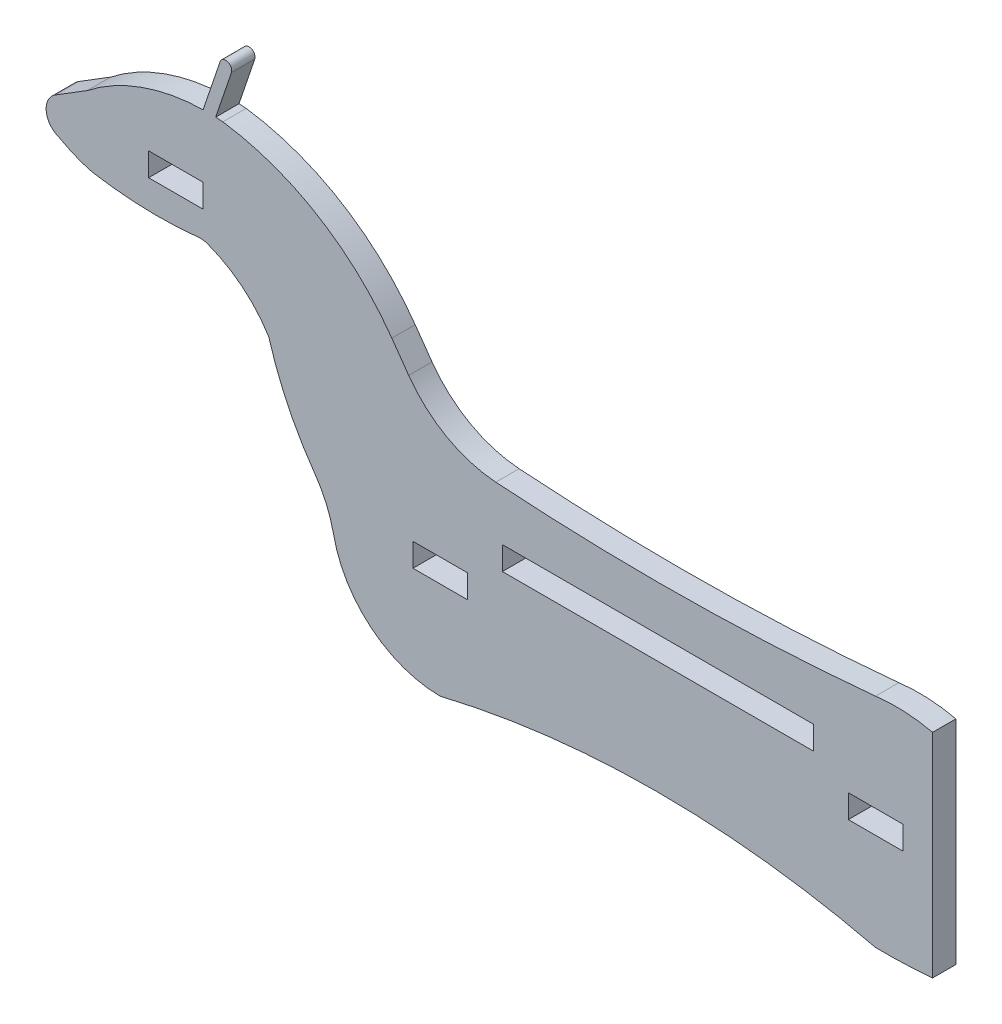
from build123d import *

# Parameters (mm, degrees)
CROQUIS1_W              = 7
CROQUIS1_H              = 3
CROQUIS1_W_2            = 40
SALIENTE_EXTRUIR2_DEPTH = 3


with BuildPart() as part:
    # Croquis1 → Saliente-Extruir2 (new body)
    # profile 1 of 2: a face of its own
    with BuildSketch(Plane.XY):
        with BuildLine():
            Line((-6.216662119, 22.772706787), (-4.044005239, 19.70673965))
            ThreePointArc((-4.044005239, 19.70673965), (0.846790636, 15.302410265), (7.152221482, 13.415735026))
            ThreePointArc((7.152221482, 13.415735026), (31.588023052, 12.711932525), (56, 14))
            ThreePointArc((56, 14), (59.681690996, 14.144560896), (63.331119209, 13.637194987))
            Line((63.331119209, 13.637194987), (63.331119209, -13.72746384))
            ThreePointArc((63.331119209, -13.72746384), (59.669008788, -13.956513649), (56, -14))
            ThreePointArc((56, -14), (28, -10.687617167), (0, -14))
            ThreePointArc((0, -14), (-8.837271963, -10.858297484), (-13.708246846, -2.843232035))
            ThreePointArc((-13.708246846, -2.843232035), (-14.641013119, 0.09458105), (-16.154579725, 2.779709497))
            ThreePointArc((-16.154579725, 2.779709497), (-19.611540214, 8.64494659), (-22.043834508, 15.003840083))
            ThreePointArc((-22.043834508, 15.003840083), (-25.456865091, 18.879465716), (-29.94492332, 21.43418393))
            ThreePointArc((-29.94492332, 21.43418393), (-30.498768872, 21.56832041), (-31.068602309, 21.573549568))
            ThreePointArc((-31.068602309, 21.573549568), (-37.926515157, 21.320049962), (-44.755343643, 22.000000093))
            ThreePointArc((-44.755343643, 22.000000093), (-46.844869797, 22.679955064), (-48.825598798, 23.631359783))
            ThreePointArc((-48.825598798, 23.631359783), (-48.970768016, 23.707234664), (-49.120594345, 23.773440183))
            ThreePointArc((-49.120594345, 23.773440183), (-50.676363257, 25.877313669), (-49.50357007, 28.216385428))
            Line((-49.50357007, 28.216385428), (-45.399966171, 30.762281564))
            ThreePointArc((-45.399966171, 30.762281564), (-37.171530842, 35.026305913), (-27.955174947, 35.999874419))
            ThreePointArc((-27.955174947, 35.999874419), (-15.716017532, 31.637687979), (-6.216662119, 22.772706787))
        make_face()
        with Locations((-34, 26.5)):
            Rectangle(CROQUIS1_W, CROQUIS1_H, mode=Mode.SUBTRACT)
        Rectangle(CROQUIS1_W, CROQUIS1_H, mode=Mode.SUBTRACT)
        with Locations((56, 0)):
            Rectangle(CROQUIS1_W, CROQUIS1_H, mode=Mode.SUBTRACT)
        with Locations((28, 5.383929272)):
            Rectangle(CROQUIS1_W_2, CROQUIS1_H, mode=Mode.SUBTRACT)
    # profile 2 of 2: a face of its own
    with BuildSketch(Plane.XY):
        with BuildLine():
            Line((-30.68397036, 35.522018262), (-28.310242026, 42.522018262))
            ThreePointArc((-28.310242026, 42.522018262), (-27.333748746, 43.003952774), (-26.851814233, 42.027459494))
            Line((-26.851814233, 42.027459494), (-29.225542567, 35.027459494))
            ThreePointArc((-29.225542567, 35.027459494), (-30.202035847, 34.545524982), (-30.68397036, 35.522018262))
        make_face()
    extrude(amount=SALIENTE_EXTRUIR2_DEPTH)


solid = part.part
